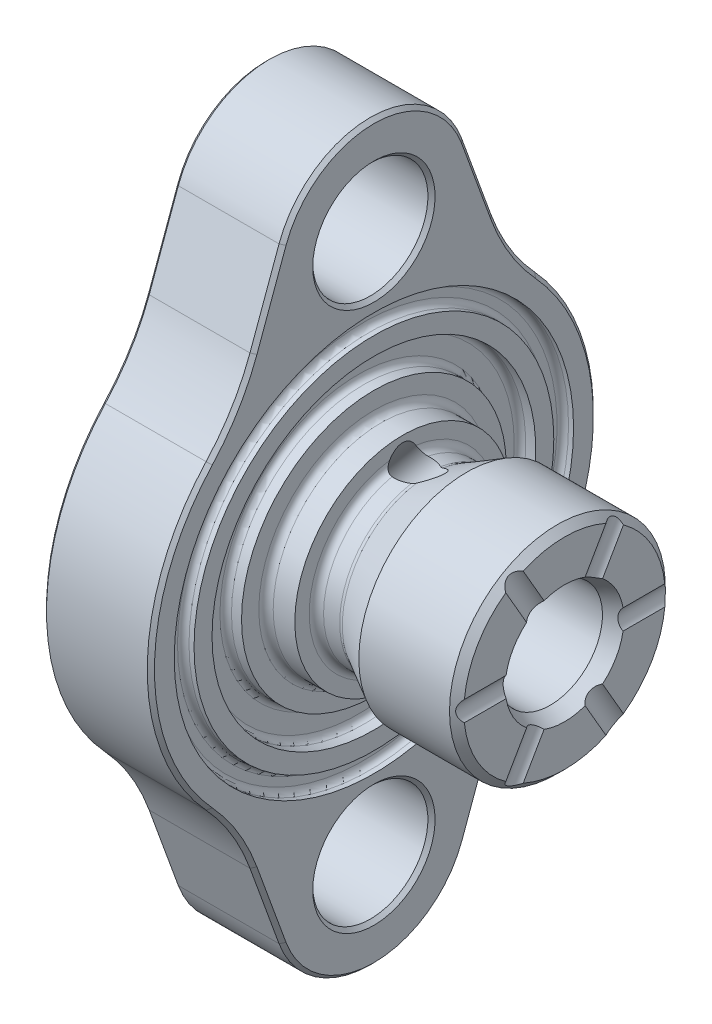
from build123d import *

# Parameters (mm, degrees)
SKETCH2_OUTSIDE_W  = 137.836
SKETCH2_OUTSIDE_H  = 137.836
CUT_EXTRUDE1_DEPTH = 86.057333605
SKETCH3_R          = 8
CUT_EXTRUDE2_DEPTH = 73.692846966
CHAMFER2_SIZE      = 1
CUT_EXTRUDE4_DEPTH = 73.692846966
CIRPATTERN1_COUNT  = 6
CIRPATTERN2_COUNT  = 2
SKETCH13_W         = 0.307692308
SKETCH13_H         = 1.153846154
SKETCH13_W_2       = 0.307692307
EXTRUDE1_DEPTH     = 0.1
CHAMFER3_SIZE      = 0.5


with BuildPart() as part:
    # Sketch1 → Revolve1 (revolve)
    with BuildSketch(Plane.XY, mode=Mode.PRIVATE) as revolve1_sk:
        with BuildLine():
            Line((0, 0), (0, 52.5))
            Line((0, 52.5), (15, 52.5))
            Line((15, 52.5), (15, 27.75))
            Line((15, 27.75), (14.3, 27.75))
            ThreePointArc((14.3, 27.75), (13.734314575, 27.515685425), (13.5, 26.95))
            Line((13.5, 26.95), (13.5, 25.8))
            ThreePointArc((13.5, 25.8), (13.734314575, 25.234314575), (14.3, 25))
            Line((14.3, 25), (15, 25))
            Line((15, 25), (15, 22.5))
            Line((15, 22.5), (13.6, 22.5))
            ThreePointArc((13.6, 22.5), (13.034314575, 22.265685425), (12.8, 21.7))
            Line((12.8, 21.7), (12.8, 19.2))
            ThreePointArc((12.8, 19.2), (13.034314575, 18.634314575), (13.6, 18.4))
            Line((13.6, 18.4), (15, 18.4))
            Line((15, 18.4), (15, 15.9975))
            ThreePointArc((15, 15.9975), (15.292893219, 15.290393219), (16, 14.9975))
            Line((16, 14.9975), (19, 14.9975))
            Line((19, 14.9975), (19, 13))
            ThreePointArc((19, 13), (19.292893219, 12.292893219), (20, 12))
            Line((20, 12), (22.241062764, 12))
            ThreePointArc((22.241062764, 12), (22.491732804, 12.031927414), (22.726396351, 12.125670937))
            Line((22.726396351, 12.125670937), (27.9, 14.9975))
            Line((27.9, 14.9975), (41.5, 14.9975))
            Line((41.5, 14.9975), (41.5, 8.25))
            Line((41.5, 8.25), (39.5, 7.265))
            Line((39.5, 7.265), (30, 7.265))
            Line((30, 7.265), (30, 7.5))
            Line((30, 7.5), (28.5, 7.5))
            Line((28.5, 7.5), (27.90815229, 6.515))
            Line((27.90815229, 6.515), (19, 6.515))
            Line((19, 6.515), (19, 6.9))
            Line((19, 6.9), (12.5, 6.9))
            Line((12.5, 6.9), (8.516283143, 0))
            Line((8.516283143, 0), (0, 0))
        make_face()
    revolve(revolve1_sk.sketch.rotate(Axis((0, 0, 0), (1, 0, 0)), 90), axis=Axis((0, 0, 0), (1, 0, 0)))

    # Sketch2 outside → Cut-Extrude1 (cut, through all)
    with BuildSketch(Plane.ZY):
        Rectangle(SKETCH2_OUTSIDE_W, SKETCH2_OUTSIDE_H)
        with BuildLine():
            Line((12.685850381, 42.117271935), (16.72864246, 31.009791985))
            ThreePointArc((16.72864246, 31.009791985), (19.282353353, 25.690256421), (22.827902518, 20.973480079))
            ThreePointArc((22.827902518, 20.973480079), (31, 0), (22.827902518, -20.973480079))
            ThreePointArc((22.827902518, -20.973480079), (19.282353353, -25.690256421), (16.72864246, -31.009791985))
            Line((16.72864246, -31.009791985), (12.685850381, -42.117271935))
            ThreePointArc((12.685850381, -42.117271935), (0, -51), (-12.685850381, -42.117271935))
            Line((-12.685850381, -42.117271935), (-16.72864246, -31.009791985))
            ThreePointArc((-16.72864246, -31.009791985), (-19.282353353, -25.690256421), (-22.827902518, -20.973480079))
            ThreePointArc((-22.827902518, -20.973480079), (-31, 0), (-22.827902518, 20.973480079))
            ThreePointArc((-22.827902518, 20.973480079), (-19.282353353, 25.690256421), (-16.72864246, 31.009791985))
            Line((-16.72864246, 31.009791985), (-12.685850381, 42.117271935))
            ThreePointArc((-12.685850381, 42.117271935), (0, 51), (12.685850381, 42.117271935))
        make_face(mode=Mode.SUBTRACT)
    extrude(amount=-CUT_EXTRUDE1_DEPTH, mode=Mode.SUBTRACT)

    # Sketch3 → Cut-Extrude2 (cut, through all)
    with BuildSketch(Plane.ZY):
        with Locations((0, 37.5)):
            Circle(SKETCH3_R)
    cut_extrude2 = extrude(amount=-CUT_EXTRUDE2_DEPTH, mode=Mode.SUBTRACT)

    # Mirror1: Cut-Extrude2 across plane
    add(cut_extrude2.mirror(Plane.ZX), mode=Mode.SUBTRACT)

    # Chamfer2
    chamfer2_edges = [part.edges().sort_by_distance(p)[0] for p in [
        (41.5, 0, -14.9975),
    ]]
    chamfer(chamfer2_edges, length=CHAMFER2_SIZE)

    # Sketch8 → Cut-Extrude4 (cut, through all)
    with BuildSketch(Plane.XY):
        with BuildLine():
            Line((45.418346774, -1.4), (41.5, -1.4))
            ThreePointArc((41.5, -1.4), (40.928285686, 0), (41.5, 1.4))
            Line((41.5, 1.4), (45.418346774, 1.4))
            Line((45.418346774, 1.4), (45.418346774, -1.4))
        make_face()
    cut_extrude4 = extrude(amount=-CUT_EXTRUDE4_DEPTH, mode=Mode.SUBTRACT)

    # CirPattern1: Cut-Extrude4 ×6 about axis
    cirpattern1_axis = Axis((30, 0, 0), (1, 0, 0))
    for i in range(1, CIRPATTERN1_COUNT):
        add(cut_extrude4.rotate(cirpattern1_axis, i * 360 / CIRPATTERN1_COUNT), mode=Mode.SUBTRACT)

    # Sketch14 → Cut-Revolve1 (revolve, cut)
    with BuildSketch(Plane.XY, mode=Mode.PRIVATE) as cut_revolve1_sk:
        Polygon((25.804414216, 14.432245132), (15.582644358, 2.25041418), (12.319126134, 2.25041418), (23.889303109, 16.039214156), align=None)
    cut_revolve1 = revolve(cut_revolve1_sk.sketch.rotate(Axis((23.889303109, 16.039214156, 0), (-0.6427876096865435, -0.7660444431189747, 0)), 133.130301737), axis=Axis((23.889303109, 16.039214156, 0), (-0.6427876096865435, -0.7660444431189747, 0)), mode=Mode.SUBTRACT)

    # CirPattern2: Cut-Revolve1 ×2 about axis
    cirpattern2_axis = Axis((30, 0, 0), (1, 0, 0))
    for i in range(1, CIRPATTERN2_COUNT):
        add(cut_revolve1.rotate(cirpattern2_axis, i * 360 / CIRPATTERN2_COUNT), mode=Mode.SUBTRACT)

    # Sketch13 → Extrude1 (cut)
    # profile 1 of 21: a face of its own
    with BuildSketch(Plane.ZY):
        Polygon((11, 14.807805177), (11, 12.961651331), (7.923076923, 14.538574408), (8.051081731, 14.771146523), (10.692307692, 13.417781139), (10.692307692, 14.807805177), align=None)
    # profile 2 of 21: a face of its own
    with BuildSketch(Plane.ZY):
        with BuildLine():
            Line((10.307692308, 12.307805177), (10.307692308, 12.577035946))
            add(Edge.make_bspline(
                [(10.307692308, 12.577035946), (10.33789158, 12.569742046), (10.396928686, 12.555483067), (10.481277767, 12.525742289), (10.561097928, 12.493342928), (10.634894563, 12.454437981), (10.704150765, 12.412001906), (10.767295729, 12.36338243), (10.825935414, 12.310822668), (10.877975332, 12.252686997), (10.925099099, 12.191719573), (10.96527772, 12.127061328), (10.99984128, 12.060013133), (11.028315764, 11.990110448), (11.049766213, 11.917145158), (11.065329189, 11.841776909), (11.075435859, 11.763808195), (11.076422227, 11.710881689), (11.076923077, 11.6840071)],
                knots=[0, 0, 0, 0, 1.162005537, 2.271625781, 3.343758855, 4.383309926, 5.390229558, 6.379919256, 7.361854164, 8.333198761, 9.295911338, 10.242430842, 11.177959212, 12.116337295, 13.062827104, 14.020064771, 14.994644689, 16, 16, 16, 16], degree=3))
            add(Edge.make_bspline(
                [(11.076923077, 11.6840071), (11.07574088, 11.644850464), (11.073402272, 11.567391312), (11.052047041, 11.453594415), (11.01825407, 11.343857141), (10.971562304, 11.239380643), (10.913973178, 11.142336272), (10.845431975, 11.055990969), (10.767261146, 10.981515103), (10.680918948, 10.919034208), (10.588642797, 10.87011278), (10.493671233, 10.834038745), (10.396229544, 10.812077305), (10.33043759, 10.809231113), (10.297475962, 10.807805177)],
                knots=[0, 0, 0, 0, 1.083050992, 2.142477498, 3.193116406, 4.255571735, 5.30263384, 6.308962982, 7.297363603, 8.282367274, 9.249857812, 10.179914175, 11.08814088, 12, 12, 12, 12], degree=3))
            add(Edge.make_bspline(
                [(10.297475962, 10.807805177), (10.265755852, 10.808802541), (10.203684519, 10.810754227), (10.113066093, 10.827325975), (10.027659007, 10.8552142), (9.947103725, 10.893845425), (9.871911006, 10.943852468), (9.801911671, 11.004429065), (9.736795249, 11.076002775), (9.699492844, 11.130241865), (9.680288462, 11.158165754)],
                knots=[0, 0, 0, 0, 1.024540389, 2.004866551, 2.965041327, 3.920577974, 4.882998113, 5.874504559, 6.905732034, 8, 8, 8, 8], degree=3))
            add(Edge.make_bspline(
                [(9.680288462, 11.158165754), (9.6648786, 11.126252822), (9.634347208, 11.063024072), (9.574470844, 10.976837904), (9.505336832, 10.898599725), (9.451385987, 10.854967966), (9.424278846, 10.833045562)],
                knots=[0, 0, 0, 0, 1.015518401, 2.012035669, 3.001164323, 4, 4, 4, 4], degree=3))
            add(Edge.make_bspline(
                [(9.424278846, 10.833045562), (9.404517165, 10.818604249), (9.365317415, 10.789958111), (9.302255422, 10.754699214), (9.238703223, 10.722346799), (9.172162029, 10.698536358), (9.10476926, 10.677988891), (9.035081767, 10.664469342), (8.963761641, 10.655790333), (8.915490179, 10.654571622), (8.891225962, 10.653959023)],
                knots=[0, 0, 0, 0, 1.02516404, 2.033540309, 3.025129118, 4.011046665, 4.991655828, 5.976607087, 6.982917762, 8, 8, 8, 8], degree=3))
            add(Edge.make_bspline(
                [(8.891225962, 10.653959023), (8.8492193, 10.655500565), (8.76540366, 10.658576393), (8.641543127, 10.685957652), (8.520676779, 10.728650861), (8.404595461, 10.788218748), (8.296212681, 10.861919873), (8.199679513, 10.950088164), (8.1161433, 11.050580265), (8.046571888, 11.162738473), (7.99091776, 11.284199632), (7.952299868, 11.41412447), (7.927145399, 11.550623726), (7.924448187, 11.64423009), (7.923076923, 11.6918196)],
                knots=[0, 0, 0, 0, 0.95570045, 1.906903359, 2.87519758, 3.868912786, 4.869932978, 5.851730567, 6.836639976, 7.83677598, 8.849487602, 9.869908895, 10.917060885, 12, 12, 12, 12], degree=3))
            add(Edge.make_bspline(
                [(7.923076923, 11.6918196), (7.923821106, 11.723893286), (7.925285409, 11.787003605), (7.935295639, 11.879783746), (7.953578501, 11.968345203), (7.978181334, 12.052807715), (8.009374256, 12.133246318), (8.048218854, 12.209415551), (8.093914427, 12.281784031), (8.14700036, 12.349668846), (8.206384365, 12.413061904), (8.273120659, 12.470278525), (8.345975577, 12.522272633), (8.425795339, 12.567652038), (8.511548417, 12.608483712), (8.604332844, 12.642067389), (8.703319149, 12.671626448), (8.772300069, 12.685369417), (8.807692308, 12.692420562)],
                knots=[0, 0, 0, 0, 1.048658725, 2.063410685, 3.046034179, 4.001477787, 4.936774919, 5.862367409, 6.792675028, 7.730719943, 8.675894397, 9.627829632, 10.600096036, 11.597688215, 12.626045268, 13.701542398, 14.82072376, 16, 16, 16, 16], degree=3))
            Line((8.807692308, 12.692420562), (8.807692308, 12.423189793))
            add(Edge.make_bspline(
                [(8.807692308, 12.423189793), (8.784593153, 12.416175543), (8.739663292, 12.402532218), (8.675000173, 12.379308534), (8.615721842, 12.352850015), (8.561393451, 12.324466107), (8.511479963, 12.294656011), (8.467301219, 12.261300361), (8.42691676, 12.226869665), (8.404164235, 12.200915933), (8.393028846, 12.188213831)],
                knots=[0, 0, 0, 0, 1.198163088, 2.33053128, 3.407730985, 4.417276592, 5.372219308, 6.28897303, 7.162600585, 8, 8, 8, 8], degree=3))
            add(Edge.make_bspline(
                [(8.393028846, 12.188213831), (8.380078846, 12.171416765), (8.354218818, 12.137874483), (8.321217423, 12.083215999), (8.292622258, 12.025731811), (8.27077909, 11.964176376), (8.252283952, 11.899878001), (8.24018065, 11.831797403), (8.231876503, 11.760535216), (8.231143705, 11.711877133), (8.230769231, 11.687011908)],
                knots=[0, 0, 0, 0, 0.946170439, 1.889420265, 2.845303464, 3.807233317, 4.801018734, 5.828864929, 6.890507805, 8, 8, 8, 8], degree=3))
            add(Edge.make_bspline(
                [(8.230769231, 11.687011908), (8.231296291, 11.658937097), (8.232326912, 11.604039228), (8.24183237, 11.523940372), (8.25561558, 11.447715018), (8.277175201, 11.376141045), (8.303039527, 11.308244506), (8.336900678, 11.24554105), (8.375141373, 11.186187271), (8.419622657, 11.131921961), (8.467702109, 11.082999131), (8.518710124, 11.0407244), (8.57106512, 11.004109648), (8.625988434, 10.974677498), (8.682941311, 10.951395286), (8.742136929, 10.935555295), (8.803076821, 10.924538978), (8.844501736, 10.923641981), (8.865384615, 10.923189793)],
                knots=[0, 0, 0, 0, 1.216990249, 2.379719373, 3.493992396, 4.571561497, 5.616923107, 6.638958652, 7.655775068, 8.674704564, 9.676001865, 10.625896028, 11.54399481, 12.441854662, 13.322657739, 14.20572845, 15.095482574, 16, 16, 16, 16], degree=3))
            add(Edge.make_bspline(
                [(8.865384615, 10.923189793), (8.893337223, 10.924501456), (8.94910335, 10.927118257), (9.031146512, 10.947097388), (9.110196997, 10.979957911), (9.184894729, 11.025968252), (9.254158865, 11.081949919), (9.315717703, 11.147361014), (9.367023445, 11.222361989), (9.402340393, 11.291835711), (9.425877654, 11.353521715), (9.442381541, 11.406206463), (9.455574456, 11.465240819), (9.468335977, 11.52991609), (9.479034427, 11.600505042), (9.487994798, 11.677071273), (9.49515324, 11.759645584), (9.498351754, 11.816809326), (9.5, 11.846266716)],
                knots=[0, 0, 0, 0, 1.070481957, 2.135637345, 3.216366529, 4.339485895, 5.485746587, 6.620975969, 7.768829582, 8.956804399, 9.598399438, 10.297751078, 11.070570279, 11.915248466, 12.824061284, 13.805856426, 14.869322739, 16, 16, 16, 16], degree=3))
            Line((9.5, 11.846266716), (9.807692308, 11.846266716))
            add(Edge.make_bspline(
                [(9.807692308, 11.846266716), (9.808324886, 11.809152457), (9.80956395, 11.73645474), (9.824446445, 11.630245181), (9.845265096, 11.528562082), (9.87641744, 11.433726474), (9.913809143, 11.347569038), (9.955971019, 11.272410167), (10.003738533, 11.210031098), (10.056484782, 11.160275981), (10.113716361, 11.123757492), (10.172742216, 11.096346749), (10.234935682, 11.080277461), (10.277355669, 11.078120256), (10.298677885, 11.077035946)],
                knots=[0, 0, 0, 0, 1.321708579, 2.588902423, 3.815526512, 5.016621128, 6.138757764, 7.158873101, 8.079948563, 8.928590313, 9.728601868, 10.489025425, 11.240515403, 12, 12, 12, 12], degree=3))
            add(Edge.make_bspline(
                [(10.298677885, 11.077035946), (10.314344561, 11.077391114), (10.345512671, 11.078097704), (10.391047891, 11.087010264), (10.435193622, 11.100400034), (10.477749556, 11.118819907), (10.518468679, 11.143429648), (10.557400946, 11.172969535), (10.59519882, 11.207453826), (10.630054006, 11.247783766), (10.662931371, 11.291445229), (10.69135263, 11.338849039), (10.715442471, 11.388949649), (10.735345814, 11.441793129), (10.750308307, 11.497591169), (10.761054045, 11.556070551), (10.767771832, 11.617345854), (10.768739073, 11.659150176), (10.769230769, 11.680401331)],
                knots=[0, 0, 0, 0, 0.884317272, 1.759307272, 2.611736065, 3.488921043, 4.37244062, 5.294096728, 6.247679003, 7.258495569, 8.302441962, 9.333537773, 10.376747089, 11.440883505, 12.520330301, 13.637364711, 14.798958396, 16, 16, 16, 16], degree=3))
            add(Edge.make_bspline(
                [(10.769230769, 11.680401331), (10.768040487, 11.714561032), (10.765715588, 11.781282874), (10.745280774, 11.877451361), (10.712903918, 11.966760699), (10.673808961, 12.034796399), (10.635349996, 12.085121609), (10.602263749, 12.121773013), (10.564750721, 12.157108721), (10.521781972, 12.189742127), (10.474835025, 12.221628695), (10.423651312, 12.252463956), (10.367501106, 12.281257479), (10.328014664, 12.298784568), (10.307692308, 12.307805177)],
                knots=[0, 0, 0, 0, 1.4727372, 2.876598283, 4.222346151, 5.558423782, 6.24313385, 6.953189256, 7.68715613, 8.463578749, 9.278833271, 10.135787152, 11.040551781, 12, 12, 12, 12], degree=3))
        make_face()
    # profile 3 of 21: a face of its own
    with BuildSketch(Plane.ZY):
        Polygon((11, 10.192420562), (11, 8.346266716), (7.923076923, 9.923189793), (8.051081731, 10.155761908), (10.692307692, 8.802396523), (10.692307692, 10.192420562), align=None)
    # profile 4 of 21: a face of its own
    with BuildSketch(Plane.ZY):
        with BuildLine():
            Line((10.076923077, 7.692420562), (10.076923077, 7.961651331))
            add(Edge.make_bspline(
                [(10.076923077, 7.961651331), (10.112641157, 7.959896927), (10.182790515, 7.956451325), (10.285065658, 7.940308565), (10.382835931, 7.91723168), (10.475263133, 7.88452635), (10.563451385, 7.844138126), (10.64622965, 7.794691252), (10.724419491, 7.737239855), (10.796540515, 7.671889333), (10.862468149, 7.600977992), (10.920002504, 7.524930704), (10.968057234, 7.44452909), (11.008448343, 7.360470519), (11.038729962, 7.271782829), (11.061208295, 7.179313776), (11.074730156, 7.082645408), (11.076183786, 7.016782606), (11.076923077, 6.983285946)],
                knots=[0, 0, 0, 0, 1.100776268, 2.161895295, 3.184016182, 4.190939212, 5.176500551, 6.166955529, 7.155448256, 8.160289653, 9.16017456, 10.133824356, 11.091467644, 12.04088621, 13.000931625, 13.972173743, 14.968683325, 16, 16, 16, 16], degree=3))
            add(Edge.make_bspline(
                [(11.076923077, 6.983285946), (11.076152971, 6.950390454), (11.074639742, 6.885751987), (11.061644574, 6.791413118), (11.041291209, 6.701604008), (11.012735138, 6.616500209), (10.974348486, 6.536780725), (10.92823631, 6.461846686), (10.874905026, 6.390805991), (10.812116043, 6.32685732), (10.745085428, 6.268136109), (10.673524368, 6.217477033), (10.599613551, 6.174094322), (10.522789379, 6.137933453), (10.442328497, 6.111313905), (10.359402323, 6.091104013), (10.273152485, 6.079680515), (10.214775438, 6.077927295), (10.185096154, 6.077035946)],
                knots=[0, 0, 0, 0, 1.111607364, 2.184268762, 3.212621178, 4.221274766, 5.211760367, 6.196651075, 7.1921475, 8.207485113, 9.220403448, 10.201281604, 11.166441695, 12.114753415, 13.065576456, 14.026450734, 14.996634279, 16, 16, 16, 16], degree=3))
            add(Edge.make_bspline(
                [(10.185096154, 6.077035946), (10.14331231, 6.07848536), (10.06047787, 6.081358753), (9.938563362, 6.106037631), (9.820537456, 6.144432267), (9.725178651, 6.19005993), (9.648818523, 6.236808893), (9.585832949, 6.278858983), (9.51803213, 6.328122308), (9.445621794, 6.385272917), (9.368041384, 6.449141828), (9.285335735, 6.520303461), (9.198359965, 6.599266511), (9.138955159, 6.654688073), (9.108173077, 6.683406139)],
                knots=[0, 0, 0, 0, 1.184136889, 2.347493852, 3.513608722, 4.697895552, 5.335178528, 6.052199267, 6.845488095, 7.711597353, 8.668264519, 9.695616787, 10.805926351, 12, 12, 12, 12], degree=3))
            Line((9.108173077, 6.683406139), (8.307692308, 7.4340071))
            Line((8.307692308, 7.4340071), (8.307692308, 6.038574408))
            Line((8.307692308, 6.038574408), (8, 6.038574408))
            Line((8, 6.038574408), (8, 8.077035946))
            Line((8, 8.077035946), (9.241586538, 6.913574408))
            add(Edge.make_bspline(
                [(9.241586538, 6.913574408), (9.271154903, 6.885245642), (9.327949679, 6.830831881), (9.410893435, 6.753901772), (9.487751152, 6.684695021), (9.558863403, 6.62316572), (9.62382705, 6.569263242), (9.683151197, 6.523160052), (9.736326742, 6.484652382), (9.798795148, 6.443842276), (9.875155888, 6.404927132), (9.968003312, 6.370724702), (10.06379382, 6.350019016), (10.128506606, 6.34752249), (10.161057692, 6.346266716)],
                knots=[0, 0, 0, 0, 1.329530082, 2.553755191, 3.672934919, 4.687409497, 5.60679272, 6.413407421, 7.126401618, 7.737995624, 8.834647426, 9.90044882, 10.943907757, 12, 12, 12, 12], degree=3))
            add(Edge.make_bspline(
                [(10.161057692, 6.346266716), (10.181529724, 6.34680604), (10.221876168, 6.347868945), (10.280991506, 6.357427285), (10.338236247, 6.371470382), (10.3929026, 6.393115134), (10.446065747, 6.419120506), (10.496109363, 6.452344287), (10.544739314, 6.490310343), (10.59028812, 6.534349107), (10.6320179, 6.582695486), (10.66898061, 6.633777931), (10.699871483, 6.687820444), (10.725194425, 6.744597808), (10.745059052, 6.803951036), (10.758823545, 6.865995111), (10.767465675, 6.930558552), (10.768634965, 6.974644405), (10.769230769, 6.997108062)],
                knots=[0, 0, 0, 0, 0.991504627, 1.954065223, 2.895985987, 3.842598665, 4.797835564, 5.759220273, 6.74786863, 7.784730864, 8.824135544, 9.839918996, 10.835834653, 11.835434876, 12.84861661, 13.863796685, 14.911511676, 16, 16, 16, 16], degree=3))
            add(Edge.make_bspline(
                [(10.769230769, 6.997108062), (10.76861807, 7.02056888), (10.767414829, 7.066642052), (10.758992773, 7.13428546), (10.744477339, 7.198821504), (10.724576987, 7.260380823), (10.699522285, 7.319022729), (10.667713455, 7.374216982), (10.630392431, 7.426467487), (10.5878485, 7.475678279), (10.540258071, 7.520895276), (10.487860271, 7.561458596), (10.430314258, 7.59605482), (10.368919822, 7.626722815), (10.302044563, 7.650188371), (10.231309021, 7.670246502), (10.155708214, 7.684817251), (10.10362097, 7.68984403), (10.076923077, 7.692420562)],
                knots=[0, 0, 0, 0, 1.031212865, 2.025131798, 2.990757446, 3.934781266, 4.865570067, 5.788494791, 6.729227313, 7.684356718, 8.643577152, 9.610526866, 10.590658432, 11.59095419, 12.621640561, 13.700587263, 14.82141059, 16, 16, 16, 16], degree=3))
        make_face()
    # profile 5 of 21: a face of its own
    with BuildSketch(Plane.ZY):
        with BuildLine():
            Line((10.076923077, 4.2308821), (10.076923077, 4.500112869))
            add(Edge.make_bspline(
                [(10.076923077, 4.500112869), (10.112641157, 4.498358466), (10.182790515, 4.494912863), (10.285065658, 4.478770103), (10.382835931, 4.455693218), (10.475263133, 4.422987889), (10.563451385, 4.382599665), (10.64622965, 4.333152791), (10.724419491, 4.275701394), (10.796540515, 4.210350871), (10.862468149, 4.139439531), (10.920002504, 4.063392242), (10.968057234, 3.982990628), (11.008448343, 3.898932057), (11.038729962, 3.810244368), (11.061208295, 3.717775314), (11.074730156, 3.621106946), (11.076183786, 3.555244144), (11.076923077, 3.521747485)],
                knots=[0, 0, 0, 0, 1.100776268, 2.161895295, 3.184016182, 4.190939212, 5.176500551, 6.166955529, 7.155448256, 8.160289653, 9.16017456, 10.133824356, 11.091467644, 12.04088621, 13.000931625, 13.972173743, 14.968683325, 16, 16, 16, 16], degree=3))
            add(Edge.make_bspline(
                [(11.076923077, 3.521747485), (11.076152971, 3.488851993), (11.074639742, 3.424213526), (11.061644574, 3.329874656), (11.041291209, 3.240065547), (11.012735138, 3.154961747), (10.974348486, 3.075242263), (10.92823631, 3.000308225), (10.874905026, 2.92926753), (10.812116043, 2.865318858), (10.745085428, 2.806597647), (10.673524368, 2.755938572), (10.599613551, 2.71255586), (10.522789379, 2.676394992), (10.442328497, 2.649775444), (10.359402323, 2.629565551), (10.273152485, 2.618142054), (10.214775438, 2.616388834), (10.185096154, 2.615497485)],
                knots=[0, 0, 0, 0, 1.111607364, 2.184268762, 3.212621178, 4.221274766, 5.211760367, 6.196651075, 7.1921475, 8.207485113, 9.220403448, 10.201281604, 11.166441695, 12.114753415, 13.065576456, 14.026450734, 14.996634279, 16, 16, 16, 16], degree=3))
            add(Edge.make_bspline(
                [(10.185096154, 2.615497485), (10.14331231, 2.616946899), (10.06047787, 2.619820291), (9.938563362, 2.644499169), (9.820537456, 2.682893806), (9.725178651, 2.728521468), (9.648818523, 2.775270431), (9.585832949, 2.817320522), (9.51803213, 2.866583847), (9.445621794, 2.923734455), (9.368041384, 2.987603366), (9.285335735, 3.058765), (9.198359965, 3.137728049), (9.138955159, 3.193149612), (9.108173077, 3.221867677)],
                knots=[0, 0, 0, 0, 1.184136889, 2.347493852, 3.513608722, 4.697895552, 5.335178528, 6.052199267, 6.845488095, 7.711597353, 8.668264519, 9.695616787, 10.805926351, 12, 12, 12, 12], degree=3))
            Line((9.108173077, 3.221867677), (8.307692308, 3.972468639))
            Line((8.307692308, 3.972468639), (8.307692308, 2.577035946))
            Line((8.307692308, 2.577035946), (8, 2.577035946))
            Line((8, 2.577035946), (8, 4.615497485))
            Line((8, 4.615497485), (9.241586538, 3.452035946))
            add(Edge.make_bspline(
                [(9.241586538, 3.452035946), (9.271154903, 3.423707181), (9.327949679, 3.36929342), (9.410893435, 3.292363311), (9.487751152, 3.22315656), (9.558863403, 3.161627259), (9.62382705, 3.107724781), (9.683151197, 3.061621591), (9.736326742, 3.02311392), (9.798795148, 2.982303814), (9.875155888, 2.94338867), (9.968003312, 2.90918624), (10.06379382, 2.888480555), (10.128506606, 2.885984028), (10.161057692, 2.884728254)],
                knots=[0, 0, 0, 0, 1.329530082, 2.553755191, 3.672934919, 4.687409497, 5.60679272, 6.413407421, 7.126401618, 7.737995624, 8.834647426, 9.90044882, 10.943907757, 12, 12, 12, 12], degree=3))
            add(Edge.make_bspline(
                [(10.161057692, 2.884728254), (10.181529724, 2.885267579), (10.221876168, 2.886330484), (10.280991506, 2.895888823), (10.338236247, 2.909931921), (10.3929026, 2.931576672), (10.446065747, 2.957582045), (10.496109363, 2.990805825), (10.544739314, 3.028771882), (10.59028812, 3.072810645), (10.6320179, 3.121157025), (10.66898061, 3.172239469), (10.699871483, 3.226281983), (10.725194425, 3.283059346), (10.745059052, 3.342412574), (10.758823545, 3.40445665), (10.767465675, 3.46902009), (10.768634965, 3.513105944), (10.769230769, 3.5355696)],
                knots=[0, 0, 0, 0, 0.991504627, 1.954065223, 2.895985987, 3.842598665, 4.797835564, 5.759220273, 6.74786863, 7.784730864, 8.824135544, 9.839918996, 10.835834653, 11.835434876, 12.84861661, 13.863796685, 14.911511676, 16, 16, 16, 16], degree=3))
            add(Edge.make_bspline(
                [(10.769230769, 3.5355696), (10.76861807, 3.559030418), (10.767414829, 3.605103591), (10.758992773, 3.672746999), (10.744477339, 3.737283043), (10.724576987, 3.798842362), (10.699522285, 3.857484268), (10.667713455, 3.91267852), (10.630392431, 3.964929026), (10.5878485, 4.014139817), (10.540258071, 4.059356814), (10.487860271, 4.099920134), (10.430314258, 4.134516358), (10.368919822, 4.165184354), (10.302044563, 4.188649909), (10.231309021, 4.20870804), (10.155708214, 4.223278789), (10.10362097, 4.228305569), (10.076923077, 4.2308821)],
                knots=[0, 0, 0, 0, 1.031212865, 2.025131798, 2.990757446, 3.934781266, 4.865570067, 5.788494791, 6.729227313, 7.684356718, 8.643577152, 9.610526866, 10.590658432, 11.59095419, 12.621640561, 13.700587263, 14.82141059, 16, 16, 16, 16], degree=3))
        make_face()
    # profile 6 of 21: a face of its own
    with BuildSketch(Plane.ZY):
        with BuildLine():
            Line((7.923076923, 1.653959023), (8.072716346, 1.869103254))
            Line((8.072716346, 1.869103254), (9.292067308, 1.034968639))
            add(Edge.make_bspline(
                [(9.292067308, 1.034968639), (9.285558968, 1.088189269), (9.272743683, 1.192983658), (9.270389408, 1.298529745), (9.269230769, 1.350473446)],
                knots=[0, 0, 0, 0, 1.015715272, 2, 2, 2, 2], degree=3))
            add(Edge.make_bspline(
                [(9.269230769, 1.350473446), (9.270039798, 1.381965759), (9.271627852, 1.443782415), (9.284143952, 1.534679078), (9.303639241, 1.622149334), (9.332054957, 1.705860006), (9.368370988, 1.785736523), (9.412608653, 1.862057617), (9.464932616, 1.934722232), (9.524780446, 2.002875325), (9.590506905, 2.064855776), (9.660068258, 2.120076015), (9.734276395, 2.165968344), (9.81161654, 2.20409115), (9.893200567, 2.233002962), (9.978100049, 2.254056567), (10.066910029, 2.267018585), (10.127360141, 2.268560667), (10.158052885, 2.269343639)],
                knots=[0, 0, 0, 0, 1.060702494, 2.082066239, 3.085748733, 4.076089625, 5.054723785, 6.037561548, 7.043420247, 8.066922603, 9.088643095, 10.08373341, 11.053858765, 12.022809492, 12.983497605, 13.964038393, 14.966267459, 16, 16, 16, 16], degree=3))
            add(Edge.make_bspline(
                [(10.158052885, 2.269343639), (10.200026016, 2.26785698), (10.282410757, 2.264938971), (10.402782559, 2.241454528), (10.516599596, 2.20283138), (10.62356262, 2.148978486), (10.722132968, 2.081148725), (10.810940347, 1.999627076), (10.88872165, 1.904909392), (10.955582288, 1.799153376), (11.009355143, 1.684850787), (11.048988829, 1.565134794), (11.072302041, 1.440922691), (11.075375636, 1.356778974), (11.076923077, 1.314415754)],
                knots=[0, 0, 0, 0, 1.022988612, 2.007919123, 2.978103895, 3.94594894, 4.918897164, 5.887013414, 6.875921846, 7.89917871, 8.930658928, 9.948724884, 10.967259574, 12, 12, 12, 12], degree=3))
            add(Edge.make_bspline(
                [(11.076923077, 1.314415754), (11.075360003, 1.272852632), (11.072271516, 1.19072782), (11.049453725, 1.069801595), (11.011406564, 0.953877712), (10.958586228, 0.84386824), (10.891948047, 0.742537865), (10.813197958, 0.651068022), (10.721448623, 0.571909201), (10.619209657, 0.505197476), (10.509350018, 0.451653212), (10.394678669, 0.413019436), (10.276016756, 0.389237561), (10.195621513, 0.386240696), (10.155048077, 0.384728254)],
                knots=[0, 0, 0, 0, 1.026337322, 2.02794581, 3.027878252, 4.032696425, 5.033228651, 6.015458494, 7.004668777, 8.016190509, 9.023163053, 10.0152653, 10.998354841, 12, 12, 12, 12], degree=3))
            add(Edge.make_bspline(
                [(10.155048077, 0.384728254), (10.123550898, 0.385725843), (10.059666749, 0.387749202), (9.962698243, 0.402284858), (9.863622273, 0.425827047), (9.779653583, 0.453134981), (9.711006066, 0.481098384), (9.655914697, 0.505157219), (9.598422542, 0.533159863), (9.538952146, 0.566422902), (9.475938848, 0.601198203), (9.410758782, 0.640738363), (9.34304772, 0.683840034), (9.297408719, 0.714553676), (9.274038462, 0.730281139)],
                knots=[0, 0, 0, 0, 1.179688711, 2.392703466, 3.66501481, 4.991562144, 5.695278944, 6.441221078, 7.243328977, 8.089575748, 8.993388627, 9.939305498, 10.944784961, 12, 12, 12, 12], degree=3))
            Line((9.274038462, 0.730281139), (7.923076923, 1.653959023))
        make_face()
        with BuildLine():
            add(Edge.make_bspline(
                [(9.576923077, 1.300593639), (9.577574834, 1.276735912), (9.578843585, 1.23029303), (9.586565792, 1.162255345), (9.60025778, 1.098034599), (9.619903248, 1.037459242), (9.643608964, 0.979921898), (9.673790666, 0.926336474), (9.709804925, 0.876658124), (9.750270652, 0.830554186), (9.795228295, 0.789613615), (9.842282958, 0.75314816), (9.891641195, 0.722153388), (9.943921135, 0.697670579), (9.99785017, 0.677540943), (10.054296761, 0.66363979), (10.112966818, 0.655938933), (10.152822811, 0.654626154), (10.173076923, 0.653959023)],
                knots=[0, 0, 0, 0, 1.163407946, 2.26475976, 3.333800367, 4.359385343, 5.366239384, 6.363380779, 7.350133999, 8.353570782, 9.349036268, 10.310270964, 11.253520213, 12.184142, 13.120487599, 14.056272588, 15.012232024, 16, 16, 16, 16], degree=3))
            add(Edge.make_bspline(
                [(10.173076923, 0.653959023), (10.193339538, 0.654532973), (10.233269505, 0.655664012), (10.292025789, 0.66473959), (10.348336665, 0.680701279), (10.40249619, 0.702132106), (10.454112613, 0.73031031), (10.503522613, 0.764249368), (10.551336923, 0.803779884), (10.595093039, 0.850171633), (10.635948588, 0.900084738), (10.67136601, 0.953752441), (10.701598686, 1.009843521), (10.726333068, 1.068402672), (10.745672946, 1.129551786), (10.759570849, 1.193294169), (10.76726166, 1.259941162), (10.768566039, 1.305182333), (10.769230769, 1.328237869)],
                knots=[0, 0, 0, 0, 0.972051712, 1.915547132, 2.843788449, 3.775556853, 4.704594175, 5.659091977, 6.648619647, 7.675179132, 8.714041218, 9.74046568, 10.755438548, 11.767722258, 12.786148662, 13.828784001, 14.893517844, 16, 16, 16, 16], degree=3))
            add(Edge.make_bspline(
                [(10.769230769, 1.328237869), (10.768565086, 1.351092951), (10.767259022, 1.395934431), (10.759584106, 1.461988113), (10.745584428, 1.52530251), (10.726323728, 1.586263369), (10.701733223, 1.64469909), (10.671366239, 1.700343994), (10.635759407, 1.753452462), (10.595145064, 1.803351331), (10.551126858, 1.849643609), (10.503731533, 1.889870302), (10.454086454, 1.923730716), (10.402503143, 1.95194799), (10.34833481, 1.973368424), (10.292026291, 1.989332896), (10.233269374, 1.998407726), (10.193339493, 1.999538867), (10.173076923, 2.000112869)],
                knots=[0, 0, 0, 0, 1.099545523, 2.15729926, 3.193054709, 4.213957097, 5.228701859, 6.237665598, 7.258567987, 8.299955741, 9.329010984, 10.327149711, 11.283968076, 12.215264062, 13.149297769, 14.079795814, 15.025585048, 16, 16, 16, 16], degree=3))
            add(Edge.make_bspline(
                [(10.173076923, 2.000112869), (10.152807038, 1.999593504), (10.112831116, 1.998569221), (10.054094208, 1.988688258), (9.997790042, 1.972164018), (9.94337115, 1.950033112), (9.8913667, 1.920888892), (9.842023247, 1.885125594), (9.794781432, 1.843206554), (9.750375251, 1.795692136), (9.709616243, 1.743690856), (9.674018773, 1.688150787), (9.643956678, 1.63002807), (9.619835492, 1.569118101), (9.600454066, 1.505872272), (9.586591027, 1.43972216), (9.578917655, 1.370886528), (9.577594315, 1.3242494), (9.576923077, 1.300593639)],
                knots=[0, 0, 0, 0, 0.952633368, 1.87876736, 2.791047057, 3.707742249, 4.635551637, 5.587206343, 6.568248508, 7.601284464, 8.641511608, 9.671105535, 10.699146789, 11.713763218, 12.747829548, 13.806491675, 14.887386225, 16, 16, 16, 16], degree=3))
        make_face(mode=Mode.SUBTRACT)
    # profile 7 of 21: a face of its own
    with BuildSketch(Plane.ZY):
        with BuildLine():
            Line((11.076923077, -1.384502515), (10.9140625, -1.592435207))
            Line((10.9140625, -1.592435207), (9.701923077, -0.799766938))
            add(Edge.make_bspline(
                [(9.701923077, -0.799766938), (9.710334957, -0.852541461), (9.726743282, -0.955484136), (9.729450092, -1.059683477), (9.730769231, -1.110464054)],
                knots=[0, 0, 0, 0, 1.025318673, 2, 2, 2, 2], degree=3))
            add(Edge.make_bspline(
                [(9.730769231, -1.110464054), (9.729961576, -1.140956299), (9.72837699, -1.20078085), (9.715854493, -1.28868465), (9.696363295, -1.373170987), (9.667836744, -1.454051383), (9.631408145, -1.531428487), (9.587745716, -1.605744756), (9.534598138, -1.675603641), (9.475228135, -1.741904646), (9.409470731, -1.802099303), (9.339698153, -1.855393064), (9.265983113, -1.900158886), (9.188362942, -1.93647939), (9.106957291, -1.964683572), (9.021870314, -1.98524441), (8.933043339, -1.997398347), (8.872633474, -1.999048767), (8.841947115, -1.999887131)],
                knots=[0, 0, 0, 0, 1.044136307, 2.048553127, 3.035567123, 4.010001674, 4.980053131, 5.96154148, 6.956538004, 7.981742224, 9.006487041, 10.005615874, 10.984750588, 11.954802044, 12.935714515, 13.930994945, 14.949008866, 16, 16, 16, 16], degree=3))
            add(Edge.make_bspline(
                [(8.841947115, -1.999887131), (8.799989469, -1.998321535), (8.717475431, -1.995242629), (8.596791933, -1.972829501), (8.482742142, -1.93414945), (8.374877863, -1.882400181), (8.276337412, -1.815259573), (8.187283268, -1.735694261), (8.109659499, -1.642952131), (8.043069301, -1.539229337), (7.990163473, -1.426969061), (7.951049114, -1.30926049), (7.927677291, -1.187109733), (7.924617433, -1.104152562), (7.923076923, -1.062387131)],
                knots=[0, 0, 0, 0, 1.031881447, 2.029301251, 3.006342947, 3.987068354, 4.962916383, 5.929513747, 6.915671209, 7.928552063, 8.953527267, 9.960179832, 10.973036711, 12, 12, 12, 12], degree=3))
            add(Edge.make_bspline(
                [(7.923076923, -1.062387131), (7.92438681, -1.022018522), (7.926981468, -0.942055377), (7.950095177, -0.824427382), (7.987558225, -0.711401507), (8.039171153, -0.603772232), (8.10436106, -0.504062814), (8.182852467, -0.414885947), (8.272910623, -0.336551896), (8.374811795, -0.271705162), (8.483606077, -0.218854897), (8.598081295, -0.181578841), (8.715933588, -0.157472318), (8.796157026, -0.154985204), (8.836538462, -0.153733284)],
                knots=[0, 0, 0, 0, 1.011913813, 2.004424092, 2.994488568, 3.992479987, 4.990471406, 5.973328987, 6.963763268, 7.974390938, 8.994854117, 9.989689954, 10.988086187, 12, 12, 12, 12], degree=3))
            add(Edge.make_bspline(
                [(8.836538462, -0.153733284), (8.867422569, -0.154820526), (8.930453956, -0.157039477), (9.026192904, -0.170281923), (9.12377053, -0.194570187), (9.206489661, -0.220855397), (9.274996089, -0.24693826), (9.329093805, -0.27112289), (9.386222731, -0.298164254), (9.44530193, -0.329860498), (9.508019423, -0.363461075), (9.57205259, -0.402710362), (9.639740121, -0.443667596), (9.684805427, -0.473671821), (9.707932692, -0.489069823)],
                knots=[0, 0, 0, 0, 1.17367173, 2.395347028, 3.66355231, 4.98980831, 5.690886799, 6.447442954, 7.240630024, 8.091733897, 8.994365608, 9.943299771, 10.944512865, 12, 12, 12, 12], degree=3))
            Line((9.707932692, -0.489069823), (11.076923077, -1.384502515))
        make_face()
        with BuildLine():
            add(Edge.make_bspline(
                [(9.423076923, -1.053973669), (9.422401193, -1.031121035), (9.421075416, -0.986284355), (9.413587448, -0.920585422), (9.399399715, -0.858573628), (9.381047827, -0.799540265), (9.356059447, -0.744102181), (9.326069887, -0.691621197), (9.290400933, -0.642639588), (9.24951111, -0.597936995), (9.205126601, -0.55703947), (9.157950787, -0.521036165), (9.108174871, -0.490685202), (9.056227121, -0.465887265), (9.001836066, -0.446621362), (8.945301833, -0.432674075), (8.886231817, -0.424914545), (8.84617547, -0.423623375), (8.825721154, -0.422964054)],
                knots=[0, 0, 0, 0, 1.129054775, 2.21519617, 3.259426851, 4.267013074, 5.263608451, 6.256463875, 7.247987236, 8.249677815, 9.244060445, 10.225610515, 11.175892485, 12.118571871, 13.063688666, 14.021206195, 14.989551517, 16, 16, 16, 16], degree=3))
            add(Edge.make_bspline(
                [(8.825721154, -0.422964054), (8.805450514, -0.423502318), (8.765702807, -0.424557775), (8.707115357, -0.434097166), (8.650786736, -0.448772709), (8.596675747, -0.470253816), (8.545077555, -0.497197405), (8.495625645, -0.530354462), (8.448285883, -0.569163558), (8.40425201, -0.614278362), (8.363863071, -0.662930305), (8.327900685, -0.714382956), (8.297701896, -0.768472717), (8.273827374, -0.82550823), (8.254273571, -0.884690951), (8.240503873, -0.946472367), (8.232721299, -1.010906762), (8.231428461, -1.054554066), (8.230769231, -1.076810207)],
                knots=[0, 0, 0, 0, 0.989642335, 1.94054129, 2.892446913, 3.828371744, 4.778262963, 5.730973156, 6.732161388, 7.763274768, 8.805796303, 9.818398792, 10.825975928, 11.825728216, 12.834635236, 13.867465554, 14.912602056, 16, 16, 16, 16], degree=3))
            add(Edge.make_bspline(
                [(8.230769231, -1.076810207), (8.231428409, -1.099066386), (8.232721146, -1.142713761), (8.240504454, -1.207147637), (8.254271436, -1.268930969), (8.273835111, -1.328106727), (8.297673195, -1.385167946), (8.328089915, -1.439305054), (8.363644418, -1.491248942), (8.404321524, -1.539868968), (8.448037071, -1.585172339), (8.496054274, -1.623072441), (8.544684519, -1.657277005), (8.596881363, -1.683185766), (8.650754162, -1.704906105), (8.707124083, -1.719507604), (8.765700523, -1.729066736), (8.805449743, -1.73011948), (8.825721154, -1.730656361)],
                knots=[0, 0, 0, 0, 1.087205562, 2.132157158, 3.164804748, 4.173533273, 5.173108684, 6.180507559, 7.20098426, 8.243321352, 9.274252308, 10.269075238, 11.227079059, 12.172305571, 13.108064818, 14.05980203, 15.010532752, 16, 16, 16, 16], degree=3))
            add(Edge.make_bspline(
                [(8.825721154, -1.730656361), (8.846204575, -1.730190179), (8.886406868, -1.729275215), (8.945248096, -1.718726065), (9.002297713, -1.704477682), (9.056270586, -1.68145099), (9.108659282, -1.654024319), (9.157966492, -1.619084543), (9.205589099, -1.579025234), (9.249773927, -1.532632667), (9.290188965, -1.482161707), (9.325862014, -1.42848952), (9.355969349, -1.372340271), (9.381089714, -1.313768204), (9.399217652, -1.252102901), (9.41349262, -1.188339769), (9.421062989, -1.121862422), (9.422398989, -1.076826494), (9.423076923, -1.053973669)],
                knots=[0, 0, 0, 0, 0.978850575, 1.921165339, 2.853482305, 3.786193361, 4.721019802, 5.678231452, 6.671107257, 7.694736563, 8.738100728, 9.761595396, 10.773671158, 11.783065439, 12.804898115, 13.84455739, 14.906252091, 16, 16, 16, 16], degree=3))
        make_face(mode=Mode.SUBTRACT)
    # profile 8 of 21: a face of its own
    with BuildSketch(Plane.ZY):
        with BuildLine():
            Line((11, -4.192194823), (10.692307692, -4.192194823))
            Line((10.692307692, -4.192194823), (10.692307692, -3.172363092))
            Line((10.692307692, -3.172363092), (9.903245192, -3.010103477))
            add(Edge.make_bspline(
                [(9.903245192, -3.010103477), (9.912013997, -3.041865655), (9.929002168, -3.103399851), (9.947864257, -3.194222589), (9.959234638, -3.280444478), (9.96078719, -3.336394795), (9.961538462, -3.363468861)],
                knots=[0, 0, 0, 0, 1.100273476, 2.13160584, 3.095893838, 4, 4, 4, 4], degree=3))
            add(Edge.make_bspline(
                [(9.961538462, -3.363468861), (9.960813184, -3.396969094), (9.959387107, -3.462838922), (9.945699647, -3.559216805), (9.924141356, -3.651210462), (9.894073597, -3.738662717), (9.855376794, -3.821761935), (9.807664445, -3.90004405), (9.751266572, -3.973952715), (9.686727319, -4.042510888), (9.61560935, -4.104610393), (9.539393104, -4.15942582), (9.458009254, -4.205014565), (9.371817674, -4.24252111), (9.280962984, -4.272278931), (9.184772679, -4.292139433), (9.084100359, -4.305349349), (9.015268218, -4.306826292), (8.980168269, -4.307579438)],
                knots=[0, 0, 0, 0, 1.052772836, 2.070014431, 3.053871312, 4.019926262, 4.972333346, 5.930471369, 6.896690565, 7.89035727, 8.885779078, 9.861050232, 10.836829716, 11.812751485, 12.812646763, 13.836748493, 14.896881366, 16, 16, 16, 16], degree=3))
            add(Edge.make_bspline(
                [(8.980168269, -4.307579438), (8.95572062, -4.307009451), (8.90715571, -4.305877178), (8.835032579, -4.300117263), (8.764434116, -4.289033694), (8.695361378, -4.274131619), (8.627906708, -4.254866481), (8.562094644, -4.231291363), (8.497722538, -4.203502112), (8.434786175, -4.172127389), (8.375225782, -4.135832649), (8.318121955, -4.097600376), (8.265576235, -4.055249541), (8.215670353, -4.010830562), (8.170364191, -3.962567305), (8.127718904, -3.911957786), (8.089586913, -3.857814324), (8.054514091, -3.80110629), (8.023111247, -3.741869443), (7.996915667, -3.679503133), (7.973955014, -3.615376464), (7.95528329, -3.548917881), (7.94079673, -3.480256135), (7.93093158, -3.409154785), (7.923753825, -3.335970604), (7.923304096, -3.286363553), (7.923076923, -3.2613054)],
                knots=[0, 0, 0, 0, 1.05623316, 2.098192244, 3.122504159, 4.140841222, 5.148757784, 6.150489607, 7.158294732, 8.176043417, 9.185147859, 10.169157858, 11.142149047, 12.097904048, 13.0527185, 13.998867679, 14.954465986, 15.910220987, 16.877849176, 17.847023716, 18.829548819, 19.818454515, 20.826519638, 21.858115382, 22.918063636, 24, 24, 24, 24], degree=3))
            add(Edge.make_bspline(
                [(7.923076923, -3.2613054), (7.923669122, -3.231413281), (7.924834203, -3.17260407), (7.937020736, -3.086443062), (7.954478222, -3.003546734), (7.980728043, -2.924571135), (8.013667747, -2.848849949), (8.055034258, -2.777391168), (8.102566261, -2.708790236), (8.157903772, -2.644911648), (8.218955449, -2.585744907), (8.28449812, -2.53196748), (8.354792393, -2.484804997), (8.429239827, -2.444064994), (8.507968523, -2.409364555), (8.591214063, -2.382091213), (8.678557676, -2.360082113), (8.738689153, -2.350770483), (8.769230769, -2.346040977)],
                knots=[0, 0, 0, 0, 1.046825758, 2.059506013, 3.044032586, 4.011925612, 4.970610144, 5.93275819, 6.900651216, 7.891265644, 8.889116719, 9.876966323, 10.858259055, 11.851035124, 12.847502422, 13.86866322, 14.9174643, 16, 16, 16, 16], degree=3))
            Line((8.769230769, -2.346040977), (8.769230769, -2.615271746))
            add(Edge.make_bspline(
                [(8.769230769, -2.615271746), (8.740619652, -2.621892055), (8.685627496, -2.634616655), (8.608408384, -2.662619922), (8.53933665, -2.696648002), (8.478347086, -2.738031587), (8.424883236, -2.786398955), (8.376827964, -2.841195027), (8.334048616, -2.903200445), (8.298160408, -2.972075683), (8.267598198, -3.044781729), (8.247236672, -3.12086548), (8.232922387, -3.19826984), (8.231489347, -3.250622644), (8.230769231, -3.2769304)],
                knots=[0, 0, 0, 0, 1.136389429, 2.184203582, 3.172920998, 4.111012962, 5.028380909, 5.957351669, 6.927793475, 7.937618031, 8.960409703, 9.974842029, 10.982339866, 12, 12, 12, 12], degree=3))
            add(Edge.make_bspline(
                [(8.230769231, -3.2769304), (8.231472755, -3.302609066), (8.232857999, -3.353170571), (8.243520009, -3.427580331), (8.259940785, -3.499419938), (8.284514946, -3.567980529), (8.314381848, -3.634461849), (8.352709056, -3.697182223), (8.396817643, -3.757956118), (8.447351897, -3.814894518), (8.503040207, -3.867042618), (8.562592258, -3.913119293), (8.626120984, -3.951499504), (8.692526544, -3.983843026), (8.762536735, -4.008402997), (8.835823457, -4.025923838), (8.912567726, -4.036212174), (8.964912848, -4.037627471), (8.991586538, -4.038348669)],
                knots=[0, 0, 0, 0, 1.027316725, 2.022795036, 3.002884548, 3.971462791, 4.93288096, 5.914575861, 6.907176829, 7.935150275, 8.956128384, 9.956726525, 10.942570165, 11.921478529, 12.907843606, 13.90538589, 14.932640048, 16, 16, 16, 16], degree=3))
            add(Edge.make_bspline(
                [(8.991586538, -4.038348669), (9.015665969, -4.037875166), (9.062825038, -4.036947821), (9.131515754, -4.026642737), (9.196982005, -4.012206913), (9.25863835, -3.990042548), (9.317387656, -3.962656593), (9.371972473, -3.927912235), (9.42379518, -3.888195854), (9.470750501, -3.841676987), (9.514380581, -3.79095014), (9.551519507, -3.734837771), (9.582777841, -3.674619761), (9.609749431, -3.610993069), (9.629121772, -3.542452096), (9.643665597, -3.470352021), (9.652078786, -3.393914872), (9.653246116, -3.341654278), (9.653846154, -3.314790977)],
                knots=[0, 0, 0, 0, 1.045726679, 2.048034203, 3.01323695, 3.95502507, 4.889743367, 5.8246644, 6.761650845, 7.722168973, 8.692072792, 9.66525385, 10.638902184, 11.638179751, 12.663148338, 13.728659964, 14.832472288, 16, 16, 16, 16], degree=3))
            add(Edge.make_bspline(
                [(9.653846154, -3.314790977), (9.653365403, -3.291335671), (9.652381232, -3.24331902), (9.644636009, -3.169493501), (9.632720729, -3.092251557), (9.615547008, -3.011293313), (9.594044327, -2.926840943), (9.567190174, -2.838754003), (9.536257576, -2.747030363), (9.512265199, -2.685293786), (9.5, -2.653733284)],
                knots=[0, 0, 0, 0, 0.824638674, 1.688163388, 2.607705698, 3.571998603, 4.597075385, 5.671199175, 6.809488238, 8, 8, 8, 8], degree=3))
            Line((9.5, -2.653733284), (11, -2.961425592))
            Line((11, -2.961425592), (11, -4.192194823))
        make_face()
    # profile 9 of 21: a face of its own
    with BuildSketch(Plane.ZY):
        with BuildLine():
            add(Edge.make_bspline(
                [(9.498798077, -5.7691179), (9.546881552, -5.769399058), (9.640284396, -5.769945212), (9.776385517, -5.776021002), (9.904065766, -5.786114152), (10.023331249, -5.799946188), (10.134212768, -5.816778735), (10.236413966, -5.839249177), (10.33040799, -5.864802925), (10.41650092, -5.894419586), (10.495854114, -5.927836731), (10.569929763, -5.964212339), (10.638633822, -6.004970163), (10.70299841, -6.047850415), (10.762305186, -6.094420055), (10.816441839, -6.144187886), (10.865441057, -6.197647586), (10.909886014, -6.253741843), (10.948603237, -6.312825158), (10.983490028, -6.373076189), (11.012123751, -6.435558115), (11.035651483, -6.49970108), (11.054503657, -6.565318549), (11.067558752, -6.63268165), (11.075740787, -6.701806656), (11.076525241, -6.748461648), (11.076923077, -6.772122707)],
                knots=[0, 0, 0, 0, 1.646377244, 3.198111528, 4.663803227, 6.031090796, 7.308794487, 8.502186765, 9.612154809, 10.642545331, 11.617106989, 12.558866172, 13.465886467, 14.35053239, 15.20542558, 16.045215227, 16.865619885, 17.686225247, 18.492864914, 19.282407821, 20.068097601, 20.842842034, 21.620163247, 22.403093475, 23.190129512, 24, 24, 24, 24], degree=3))
            add(Edge.make_bspline(
                [(11.076923077, -6.772122707), (11.07650495, -6.795981689), (11.075673426, -6.843429697), (11.067681475, -6.91357859), (11.054420513, -6.982106888), (11.035631106, -7.048722436), (11.012320526, -7.113972424), (10.983102997, -7.177346488), (10.949092539, -7.239238272), (10.909129216, -7.298664233), (10.864572979, -7.35627676), (10.814204977, -7.410660729), (10.758533789, -7.461821088), (10.698155049, -7.510399921), (10.63191069, -7.555019004), (10.560952882, -7.597510518), (10.484040712, -7.635543691), (10.402457454, -7.672173413), (10.313945746, -7.70379083), (10.219004523, -7.732304755), (10.116512363, -7.755343871), (10.00700701, -7.774534675), (9.89008631, -7.789401729), (9.766000897, -7.800229708), (9.634669133, -7.805949495), (9.544876691, -7.807026668), (9.498798077, -7.807579438)],
                knots=[0, 0, 0, 0, 0.810914788, 1.612654377, 2.396697861, 3.181598691, 3.963628158, 4.749916497, 5.551656086, 6.361998678, 7.18212741, 8.025565596, 8.878627764, 9.750805457, 10.657531673, 11.591944965, 12.560506719, 13.57287815, 14.630710178, 15.753379473, 16.941251878, 18.199788006, 19.531962791, 20.947069417, 22.433333509, 24, 24, 24, 24], degree=3))
            add(Edge.make_bspline(
                [(9.498798077, -7.807579438), (9.452920613, -7.807020247), (9.363530246, -7.805930685), (9.23278704, -7.800301331), (9.109368472, -7.789160428), (8.992930991, -7.775380888), (8.884165925, -7.755752125), (8.782039049, -7.73343768), (8.687431701, -7.70570322), (8.599386797, -7.67451675), (8.518203244, -7.638681857), (8.441955943, -7.600312541), (8.371056034, -7.558081849), (8.304812638, -7.513196667), (8.243910257, -7.465030748), (8.188198373, -7.413653755), (8.137713732, -7.359026581), (8.092548717, -7.301283798), (8.053050595, -7.240922983), (8.017745626, -7.179237786), (7.989097834, -7.114997026), (7.964909947, -7.049628401), (7.946077315, -6.982515115), (7.933182738, -6.913722999), (7.924114216, -6.843477343), (7.923423885, -6.795989944), (7.923076923, -6.772122707)],
                knots=[0, 0, 0, 0, 1.56130642, 3.042141888, 4.451772327, 5.777565838, 7.030558081, 8.211376819, 9.333164717, 10.383253789, 11.387583522, 12.350962576, 13.286244149, 14.193812918, 15.072134482, 15.925989337, 16.770211267, 17.600669898, 18.417446232, 19.22325363, 20.01647746, 20.807971184, 21.593601364, 22.38506573, 23.188331689, 24, 24, 24, 24], degree=3))
            add(Edge.make_bspline(
                [(7.923076923, -6.772122707), (7.923478587, -6.748462609), (7.92427059, -6.701809512), (7.932397328, -6.632670622), (7.9456493, -6.565412581), (7.963645411, -6.499900935), (7.986517401, -6.436001613), (8.015609725, -6.374340573), (8.049352296, -6.314103485), (8.087740784, -6.25556521), (8.131732992, -6.199841456), (8.180387068, -6.146612955), (8.234923354, -6.097223709), (8.294468914, -6.051237736), (8.358518504, -6.007599544), (8.42770306, -5.967241117), (8.502472754, -5.930936462), (8.582264003, -5.89677041), (8.668989672, -5.866653101), (8.763485022, -5.840250558), (8.866272778, -5.818240345), (8.977047794, -5.800539618), (9.095892981, -5.785947149), (9.223017589, -5.776068794), (9.358311937, -5.769940374), (9.45111482, -5.769397061), (9.498798077, -5.7691179)],
                knots=[0, 0, 0, 0, 0.810940842, 1.599017053, 2.38298203, 3.159479784, 3.926441347, 4.70693857, 5.494146311, 6.292334103, 7.104379492, 7.925868426, 8.762126819, 9.623561095, 10.503686106, 11.41783325, 12.366995289, 13.351843594, 14.392337808, 15.512229747, 16.713911458, 17.994391108, 19.357476964, 20.818259213, 22.365182633, 24, 24, 24, 24], degree=3))
        make_face()
        with BuildLine():
            add(Edge.make_bspline(
                [(9.5, -6.038348669), (9.459929687, -6.038451052), (9.382161077, -6.038649758), (9.269152568, -6.043840787), (9.163749428, -6.050912414), (9.065817827, -6.060033528), (8.975689238, -6.073578905), (8.892743819, -6.088756178), (8.817420395, -6.107225881), (8.749202531, -6.129079043), (8.686931016, -6.153968712), (8.628990206, -6.181148608), (8.574677616, -6.210331336), (8.524544883, -6.243048268), (8.478092971, -6.278557315), (8.43545537, -6.316916784), (8.396818119, -6.358059212), (8.350971273, -6.41501382), (8.303034266, -6.489834222), (8.26180478, -6.584588652), (8.235726998, -6.681995554), (8.232419904, -6.748128251), (8.230769231, -6.781137131)],
                knots=[0, 0, 0, 0, 1.459116078, 2.831857795, 4.118796693, 5.306371758, 6.412361096, 7.436813035, 8.376339383, 9.234574298, 10.043323891, 10.816788787, 11.564361537, 12.286735248, 12.994408768, 13.691741332, 14.372975427, 15.047457468, 16.352811911, 17.594285292, 18.799233213, 20, 20, 20, 20], degree=3))
            add(Edge.make_bspline(
                [(8.230769231, -6.781137131), (8.232138757, -6.814357992), (8.234874982, -6.880731126), (8.2612739, -6.977702951), (8.301104934, -7.071843182), (8.348202796, -7.145619131), (8.39305565, -7.201747025), (8.431296777, -7.241961588), (8.474116092, -7.278871915), (8.520315488, -7.313879408), (8.570777617, -7.345987187), (8.625259825, -7.375184163), (8.683913406, -7.401827032), (8.724858896, -7.417006214), (8.745793269, -7.424766938)],
                knots=[0, 0, 0, 0, 1.353760809, 2.704726607, 4.075137775, 5.516104923, 6.260822281, 7.007110065, 7.778089737, 8.566572457, 9.372053459, 10.217411131, 11.088608312, 12, 12, 12, 12], degree=3))
            add(Edge.make_bspline(
                [(8.745793269, -7.424766938), (8.772561617, -7.433811311), (8.826912844, -7.452175265), (8.911224546, -7.4758425), (8.999684058, -7.494481414), (9.091762729, -7.511250013), (9.188139616, -7.52269549), (9.288516516, -7.531907901), (9.392969112, -7.537334204), (9.463936248, -7.538006848), (9.5, -7.538348669)],
                knots=[0, 0, 0, 0, 0.884706709, 1.796334032, 2.740027952, 3.714592787, 4.726048262, 5.777819803, 6.87074269, 8, 8, 8, 8], degree=3))
            add(Edge.make_bspline(
                [(9.5, -7.538348669), (9.536062977, -7.537971677), (9.606618597, -7.537234109), (9.709841532, -7.532388219), (9.808052396, -7.524601277), (9.901340284, -7.514061821), (9.989539154, -7.499593378), (10.072775216, -7.482218217), (10.151026032, -7.461847835), (10.224493403, -7.438482399), (10.292913268, -7.412149876), (10.356434591, -7.383060335), (10.415394124, -7.352017852), (10.469622631, -7.318294743), (10.519364886, -7.282298742), (10.563623091, -7.24307791), (10.603769069, -7.202188467), (10.649594126, -7.144916587), (10.696318437, -7.069938627), (10.73931766, -6.976642357), (10.764010482, -6.879553234), (10.767491928, -6.813918844), (10.769230769, -6.781137131)],
                knots=[0, 0, 0, 0, 1.313668642, 2.570134578, 3.763346207, 4.902004944, 5.98888779, 7.017888835, 7.998425394, 8.933058446, 9.82474457, 10.667209444, 11.476765193, 12.250262638, 12.991704352, 13.7104269, 14.401925311, 15.076585796, 16.378385137, 17.609787933, 18.806186071, 20, 20, 20, 20], degree=3))
            add(Edge.make_bspline(
                [(10.769230769, -6.781137131), (10.767491773, -6.74795523), (10.764010611, -6.681530979), (10.739382411, -6.583453838), (10.69671877, -6.489492974), (10.649292396, -6.415116555), (10.604580301, -6.357916935), (10.565698494, -6.317526017), (10.522931907, -6.279764715), (10.47667666, -6.244226085), (10.426518642, -6.211540647), (10.372213951, -6.182345976), (10.314267756, -6.155181683), (10.25201041, -6.130238577), (10.183689703, -6.108587937), (10.108746428, -6.089236259), (10.025723535, -6.074068194), (9.935342971, -6.060831897), (9.837290981, -6.050739972), (9.731644838, -6.043858941), (9.618440901, -6.038640366), (9.540271037, -6.038447849), (9.5, -6.038348669)],
                knots=[0, 0, 0, 0, 1.207964612, 2.418129846, 3.655795183, 4.951004962, 5.620895151, 6.296795572, 6.989224116, 7.696855977, 8.419187164, 9.166715907, 9.940135271, 10.748837255, 11.607021648, 12.548275234, 13.5654991, 14.678641405, 15.874140913, 17.15372626, 18.533675393, 20, 20, 20, 20], degree=3))
        make_face(mode=Mode.SUBTRACT)
    # profile 10 of 21: a face of its own
    with BuildSketch(Plane.ZY):
        Polygon((11, -8.7144304), (11, -9.2691179), (8, -9.2691179), (8, -8.999887131), (10.692307692, -8.999887131), (10.692307692, -8.538348669), align=None)
    # profile 11 of 21: a face of its own
    with BuildSketch(Plane.ZY):
        with Locations((9.153846154, -12.115271746)):
            Rectangle(SKETCH13_W, SKETCH13_H)
    # profile 12 of 21: a face of its own
    with BuildSketch(Plane.ZY):
        with BuildLine():
            Line((11, -14.346040977), (11, -14.931377515))
            add(Edge.make_bspline(
                [(11, -14.931377515), (10.999849357, -14.960030496), (10.999557373, -15.015567105), (10.995028975, -15.096326627), (10.9888544, -15.171968465), (10.979057178, -15.242514555), (10.967235655, -15.3079323), (10.952919813, -15.368418846), (10.935754144, -15.423781851), (10.908457331, -15.489878482), (10.867894616, -15.565239049), (10.807955845, -15.646837671), (10.734642306, -15.716612733), (10.651942887, -15.776772434), (10.560969368, -15.824601965), (10.463890063, -15.85920422), (10.361957142, -15.88111097), (10.291977275, -15.883363914), (10.256610577, -15.884502515)],
                knots=[0, 0, 0, 0, 1.001505555, 1.941167018, 2.826882275, 3.653841531, 4.429895133, 5.150066043, 5.825578002, 6.45369114, 7.647487171, 8.808567382, 9.977351308, 11.170798116, 12.373658725, 13.556498008, 14.765093433, 16, 16, 16, 16], degree=3))
            add(Edge.make_bspline(
                [(10.256610577, -15.884502515), (10.223474201, -15.883583581), (10.158358099, -15.881777789), (10.063272011, -15.863922087), (9.972385253, -15.837337494), (9.88681827, -15.798744519), (9.807670783, -15.749102011), (9.735413163, -15.689362983), (9.671796512, -15.61823586), (9.636379606, -15.56486015), (9.618389423, -15.537747707)],
                knots=[0, 0, 0, 0, 1.044266239, 2.052081639, 3.041743201, 4.026043445, 5.00270663, 5.980942822, 6.97441044, 8, 8, 8, 8], degree=3))
            add(Edge.make_bspline(
                [(9.618389423, -15.537747707), (9.605315235, -15.571833782), (9.580301076, -15.637048885), (9.535835702, -15.726858012), (9.488018042, -15.8045449), (9.435522377, -15.87019506), (9.378230028, -15.925495159), (9.317288243, -15.975155797), (9.249696774, -16.016760276), (9.17738024, -16.052502032), (9.100846195, -16.080630418), (9.020444658, -16.100533097), (8.937074664, -16.112762325), (8.880249541, -16.114429902), (8.8515625, -16.115271746)],
                knots=[0, 0, 0, 0, 1.272302504, 2.434229863, 3.488457646, 4.447234501, 5.35599188, 6.26022912, 7.18267843, 8.11661068, 9.06895546, 10.019249207, 11.000057067, 12, 12, 12, 12], degree=3))
            add(Edge.make_bspline(
                [(8.8515625, -16.115271746), (8.822276776, -16.114434187), (8.764656293, -16.112786265), (8.680006663, -16.100635757), (8.599122568, -16.080042728), (8.521428911, -16.051746782), (8.447365466, -16.014607182), (8.37600465, -15.970383597), (8.309247466, -15.916557889), (8.245506355, -15.856561519), (8.188229179, -15.788609175), (8.137236587, -15.715304552), (8.095108025, -15.635593288), (8.060161354, -15.550711494), (8.033077862, -15.460095128), (8.014275246, -15.364080174), (8.00157652, -15.262645766), (8.000534423, -15.193036907), (8, -15.157339054)],
                knots=[0, 0, 0, 0, 0.978404568, 1.925038397, 2.85041836, 3.763147166, 4.682162379, 5.614488577, 6.562659439, 7.54271123, 8.535210642, 9.526693784, 10.520907202, 11.541451354, 12.589717429, 13.675358278, 14.807842563, 16, 16, 16, 16], degree=3))
            Line((8, -15.157339054), (8, -14.346040977))
            Line((8, -14.346040977), (11, -14.346040977))
        make_face()
        with BuildLine():
            Line((10.692307692, -14.615271746), (9.730769231, -14.615271746))
            Line((9.730769231, -14.615271746), (9.730769231, -14.796161169))
            add(Edge.make_bspline(
                [(9.730769231, -14.796161169), (9.731109169, -14.822603232), (9.731766, -14.873694685), (9.73370681, -14.947879792), (9.738903185, -15.016568922), (9.744399209, -15.079998767), (9.752861961, -15.137744191), (9.763217992, -15.189998511), (9.774074693, -15.237231133), (9.792590011, -15.291675963), (9.819676265, -15.353415679), (9.862700362, -15.418814233), (9.912553151, -15.47740446), (9.971137635, -15.52632656), (10.035098913, -15.566695845), (10.104442686, -15.593636553), (10.176461798, -15.612745244), (10.226033344, -15.614420952), (10.251201923, -15.615271746)],
                knots=[0, 0, 0, 0, 1.156481963, 2.23455883, 3.244418989, 4.168404366, 5.01828131, 5.794834307, 6.498111525, 7.13526334, 8.307595709, 9.435046769, 10.546766856, 11.659452936, 12.760769924, 13.837671619, 14.902137667, 16, 16, 16, 16], degree=3))
            add(Edge.make_bspline(
                [(10.251201923, -15.615271746), (10.267860427, -15.614846228), (10.3005379, -15.614011528), (10.347990642, -15.606414765), (10.393191053, -15.595391787), (10.435099555, -15.578170534), (10.474907306, -15.557346479), (10.510846179, -15.530258163), (10.544885118, -15.49966627), (10.575774299, -15.463739068), (10.603451126, -15.422650521), (10.627804306, -15.376009129), (10.647014791, -15.32325797), (10.664247618, -15.265593118), (10.676205323, -15.202091697), (10.686203556, -15.133374203), (10.691285935, -15.058857685), (10.69195951, -15.00730489), (10.692307692, -14.980656361)],
                knots=[0, 0, 0, 0, 0.911752476, 1.788502045, 2.626783689, 3.45400582, 4.26402138, 5.080402872, 5.911472738, 6.767166405, 7.66795952, 8.620018292, 9.640966946, 10.73819047, 11.913090943, 13.176185384, 14.540321519, 16, 16, 16, 16], degree=3))
            Line((10.692307692, -14.980656361), (10.692307692, -14.615271746))
        make_face(mode=Mode.SUBTRACT)
        with BuildLine():
            Line((9.423076923, -14.615271746), (8.307692308, -14.615271746))
            Line((8.307692308, -14.615271746), (8.307692308, -14.998685207))
            add(Edge.make_bspline(
                [(8.307692308, -14.998685207), (8.308020085, -15.026130137), (8.308651833, -15.079026621), (8.310736742, -15.155397293), (8.315379525, -15.22599018), (8.322948498, -15.290845903), (8.330813322, -15.35053537), (8.341698617, -15.404465565), (8.354073882, -15.452719166), (8.373225191, -15.508663329), (8.402926304, -15.5717005), (8.448000921, -15.639585186), (8.500993281, -15.700542847), (8.563098375, -15.751713751), (8.630115787, -15.793968677), (8.701694994, -15.823604522), (8.775652328, -15.842659945), (8.826208171, -15.844911697), (8.8515625, -15.846040977)],
                knots=[0, 0, 0, 0, 1.159821618, 2.235403267, 3.228114831, 4.14795534, 4.994323282, 5.771256229, 6.471395042, 7.097801288, 8.267864287, 9.404187171, 10.531774336, 11.667624178, 12.792825787, 13.866573821, 14.930062559, 16, 16, 16, 16], degree=3))
            add(Edge.make_bspline(
                [(8.8515625, -15.846040977), (8.867415986, -15.845810156), (8.898867238, -15.845352236), (8.945050899, -15.838186573), (8.98998712, -15.828190004), (9.032996398, -15.813714114), (9.074778588, -15.795461189), (9.114605909, -15.772554461), (9.153430646, -15.74610153), (9.202457491, -15.704720404), (9.25896397, -15.644587641), (9.314279762, -15.559119791), (9.358892751, -15.461944919), (9.377835077, -15.391464014), (9.387620192, -15.3550554)],
                knots=[0, 0, 0, 0, 0.723503378, 1.435336582, 2.130201219, 2.824764462, 3.504949994, 4.209866579, 4.920640069, 5.648298893, 7.13757748, 8.670694625, 10.280166878, 12, 12, 12, 12], degree=3))
            add(Edge.make_bspline(
                [(9.387620192, -15.3550554), (9.390581892, -15.340459046), (9.397003468, -15.308811139), (9.403777671, -15.257204379), (9.409854352, -15.198090362), (9.41423126, -15.131721751), (9.418929794, -15.05783459), (9.420692031, -14.976452616), (9.422842935, -14.887518295), (9.422996932, -14.825810472), (9.423076923, -14.793757323)],
                knots=[0, 0, 0, 0, 0.634452549, 1.375623993, 2.216454381, 3.166361212, 4.209414599, 5.370755378, 6.634280627, 8, 8, 8, 8], degree=3))
            Line((9.423076923, -14.793757323), (9.423076923, -14.615271746))
        make_face(mode=Mode.SUBTRACT)
    # profile 13 of 21: a face of its own
    with BuildSketch(Plane.ZY):
        Polygon((4.884615385, 8.7855696), (4.884615385, 8.2308821), (1.884615385, 8.2308821), (1.884615385, 8.500112869), (4.576923077, 8.500112869), (4.576923077, 8.961651331), align=None)
    # profile 14 of 21: a face of its own
    with BuildSketch(Plane.ZY):
        Polygon((4.884615385, 6.477877293), (4.884615385, 5.923189793), (1.884615385, 5.923189793), (1.884615385, 6.192420562), (4.576923077, 6.192420562), (4.576923077, 6.653959023), align=None)
    # profile 15 of 21: a face of its own
    with BuildSketch(Plane.ZY):
        Polygon((4.884615385, 4.170184985), (4.884615385, 3.615497485), (1.884615385, 3.615497485), (1.884615385, 3.884728254), (4.576923077, 3.884728254), (4.576923077, 4.346266716), align=None)
    # profile 16 of 21: a face of its own
    with BuildSketch(Plane.ZY):
        Polygon((4.884615385, 1.862492677), (4.884615385, 1.307805177), (1.884615385, 1.307805177), (1.884615385, 1.577035946), (4.576923077, 1.577035946), (4.576923077, 2.038574408), align=None)
    # profile 17 of 21: a face of its own
    with BuildSketch(Plane.ZY):
        Polygon((4.884615385, -0.445199631), (4.884615385, -0.999887131), (1.884615385, -0.999887131), (1.884615385, -0.730656361), (4.576923077, -0.730656361), (4.576923077, -0.2691179), align=None)
    # profile 18 of 21: a face of its own
    with BuildSketch(Plane.ZY):
        with Locations((3.038461539, -3.846040977)):
            Rectangle(SKETCH13_W_2, SKETCH13_H)
    # profile 19 of 21: a face of its own
    with BuildSketch(Plane.ZY):
        Polygon((4.884615385, -5.865271746), (4.884615385, -6.175968861), (3.658052885, -6.960824631), (4.884615385, -7.745079438), (4.884615385, -8.057579438), (3.414663462, -7.117074631), (1.884615385, -8.096040977), (1.884615385, -7.785343861), (3.171875, -6.961425592), (1.884615385, -6.138108284), (1.884615385, -5.826810207), (3.415264423, -6.805776554), align=None)
    # profile 20 of 21: a face of its own
    with BuildSketch(Plane.ZY):
        Polygon((4.884615385, -8.403733284), (4.884615385, -8.7144304), (3.658052885, -9.499286169), (4.884615385, -10.283540977), (4.884615385, -10.596040977), (3.414663462, -9.655536169), (1.884615385, -10.634502515), (1.884615385, -10.3238054), (3.171875, -9.499887131), (1.884615385, -8.676569823), (1.884615385, -8.365271746), (3.415264423, -9.344238092), align=None)
    # profile 21 of 21: a face of its own
    with BuildSketch(Plane.ZY):
        with BuildLine():
            Line((12.842496826, -2.449753376), (12.842496826, 1.472369837))
            Line((12.842496826, 1.472369837), (12.842496826, 4.469290151))
            Line((12.842496826, 4.469290151), (15.805510799, 2.784407341))
            ThreePointArc((15.805510799, 2.784407341), (16.663909017, 1.865253289), (16.97555779, 0.646825321))
            Line((16.97555779, 0.646825321), (16.97555779, -0.037218831))
            Line((16.97555779, -0.037218831), (19.692285333, 1.472369837))
            Line((19.692285333, 1.472369837), (19.692285333, -0.452469402))
            ThreePointArc((19.692285333, -0.452469402), (19.433091598, -1.431230847), (18.72345325, -2.153428032))
            Line((18.72345325, -2.153428032), (16.97555779, -3.190016968))
            Line((16.97555779, -3.190016968), (16.218718109, -3.602763722))
            Line((16.218718109, -3.602763722), (15.599055417, -3.961291516))
            ThreePointArc((15.599055417, -3.961291516), (13.773261915, -4.021644181), (12.842496826, -2.449753376))
        make_face()
        Polygon((13.642031258, -1.868812017), (13.642031258, 1.01772405), (16.218718109, -0.447478417), align=None, mode=Mode.SUBTRACT)
        with BuildLine():
            Line((12.962496826, 1.404133258), (13.522031258, 1.085960629))
            Line((13.522031258, 1.085960629), (13.522031258, -2.072051484))
            Line((13.522031258, -2.072051484), (16.218718109, -0.584524341))
            Line((16.218718109, -0.584524341), (16.218718109, -3.464125489))
            Line((16.218718109, -3.464125489), (15.536680041, -3.858742766))
            ThreePointArc((15.536680041, -3.858742766), (13.83207357, -3.917035756), (12.962496826, -2.449753376))
            Line((12.962496826, -2.449753376), (12.962496826, 1.404133258))
        make_face(mode=Mode.SUBTRACT)
        with BuildLine():
            Line((16.339128568, -3.427935575), (16.85555779, -3.121667363))
            Line((16.85555779, -3.121667363), (16.85555779, 0.646825321))
            ThreePointArc((16.85555779, 0.646825321), (16.559387712, 1.806280399), (15.743442025, 2.681657707))
            Line((15.743442025, 2.681657707), (12.962496826, 4.263009265))
            Line((12.962496826, 4.263009265), (12.962496826, 1.542177565))
            Line((12.962496826, 1.542177565), (16.339128568, -0.377904092))
            Line((16.339128568, -0.377904092), (16.339128568, -3.427935575))
        make_face(mode=Mode.SUBTRACT)
        with BuildLine():
            Line((19.572285333, -0.452469402), (19.572285333, 1.268408704))
            Line((19.572285333, 1.268408704), (16.97555779, -0.174500241))
            Line((16.97555779, -0.174500241), (16.97555779, -3.050501395))
            Line((16.97555779, -3.050501395), (18.662242047, -2.050213748))
            ThreePointArc((18.662242047, -2.050213748), (19.328819492, -1.371839537), (19.572285333, -0.452469402))
        make_face(mode=Mode.SUBTRACT)
    extrude(amount=-EXTRUDE1_DEPTH, mode=Mode.SUBTRACT)

    # Chamfer3
    chamfer3_edges = [part.edges().sort_by_distance(p)[0] for p in [
        (15, 37.5, -8),
        (0, 37.5, -8),
        (0, -37.5, -8),
        (15, -37.5, -8),
        (15, 0, -31),
        (15, -25.690256421, -19.282353353),
        (15, -36.56353196, -14.70724642),
        (15, -51, 0),
        (15, -36.56353196, 14.70724642),
        (15, -25.690256421, 19.282353353),
        (15, 0, 31),
        (15, 25.690256421, 19.282353353),
        (15, 36.56353196, 14.70724642),
        (15, 51, 0),
        (15, 36.56353196, -14.70724642),
        (15, 25.690256421, -19.282353353),
        (0, 25.690256421, -19.282353353),
        (0, 36.56353196, -14.70724642),
        (0, 51, 0),
        (0, 36.56353196, 14.70724642),
        (0, 25.690256421, 19.282353353),
        (0, 0, 31),
        (0, -25.690256421, 19.282353353),
        (0, -36.56353196, 14.70724642),
        (0, -51, 0),
        (0, -36.56353196, -14.70724642),
        (0, -25.690256421, -19.282353353),
        (0, 0, -31),
    ]]
    chamfer(chamfer3_edges, length=CHAMFER3_SIZE)


solid = part.part
